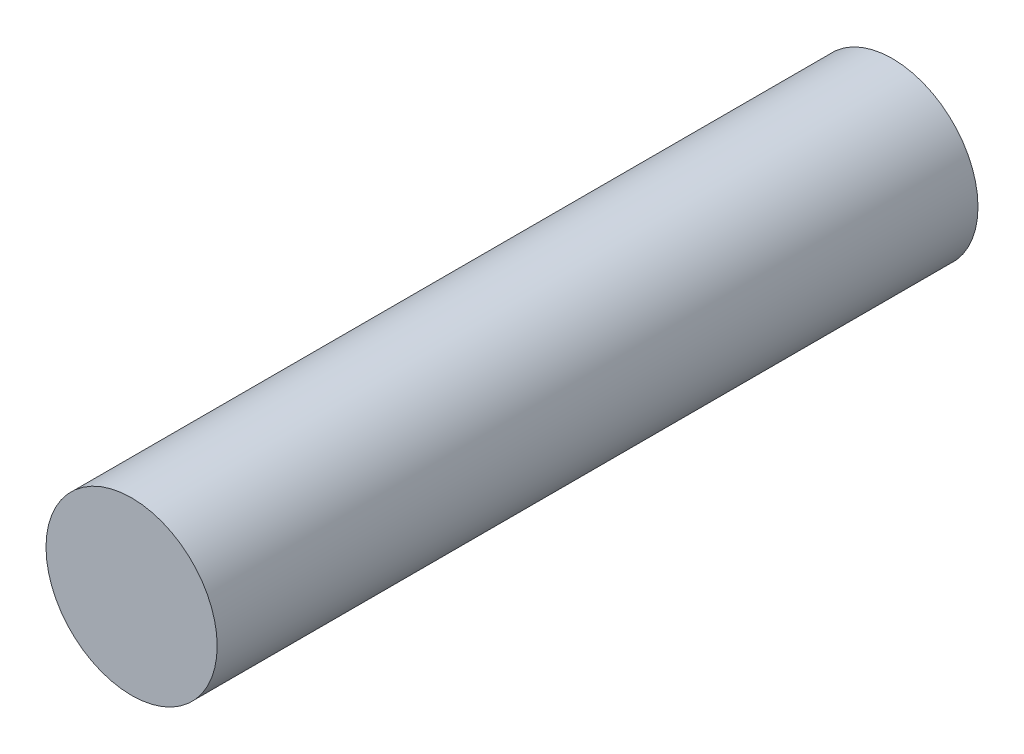
from build123d import *

# Parameters (mm, degrees)
SKETCH_1_R      = 9
EXTRUDE_1_DEPTH = 80


with BuildPart() as part:
    # Эскиз1 → Бобышка-Вытянуть1 (new body)
    with BuildSketch(Plane.XY):
        Circle(SKETCH_1_R)
    extrude(amount=EXTRUDE_1_DEPTH)


solid = part.part
